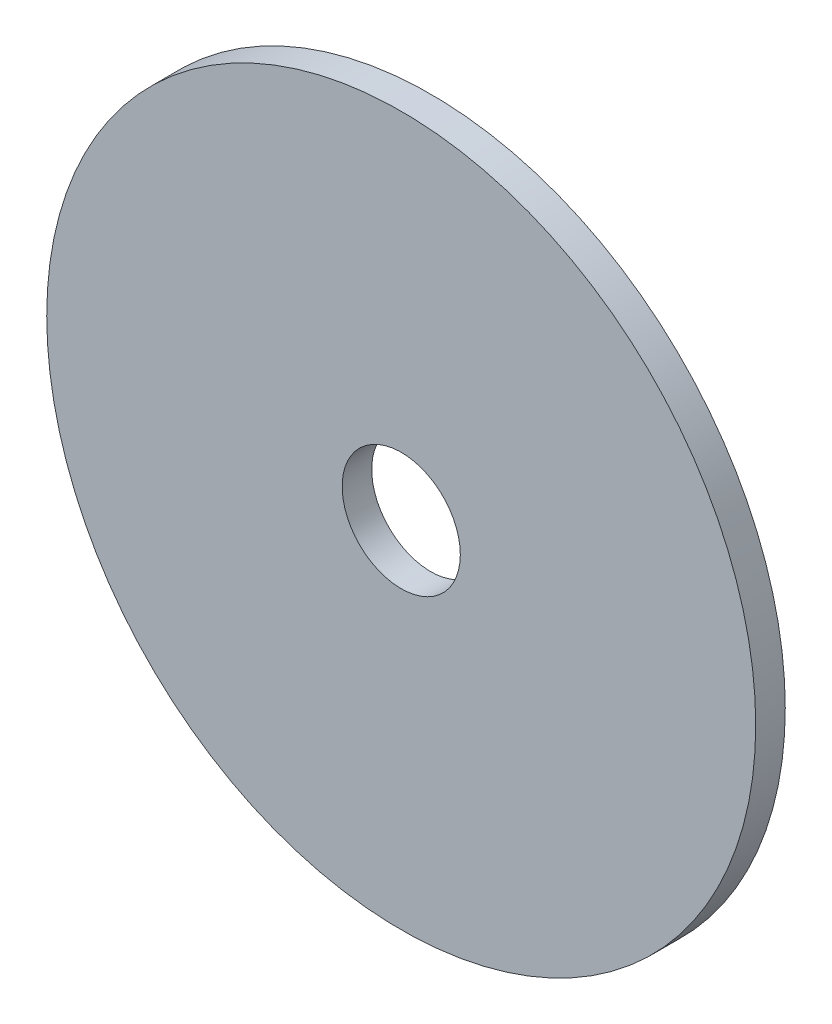
from build123d import *

# Parameters (mm, degrees)
SKETCH2_R           = 38.1
BOSS_EXTRUDE1_DEPTH = 3.175
CUT_EXTRUDE1_REACH  = 55.975
SKETCH3_R           = 6.35


with BuildPart() as part:
    # Sketch2 → Boss-Extrude1 (new body)
    with BuildSketch(Plane.XY):
        Circle(SKETCH2_R)
    extrude(amount=BOSS_EXTRUDE1_DEPTH)

    # Sketch3 → Cut-Extrude1 (cut, up to next)
    with BuildSketch(Plane.XY.offset(3.175), mode=Mode.PRIVATE) as cut_extrude1_sk1:
        Circle(SKETCH3_R)
    cut_extrude1_tool1 = extrude(cut_extrude1_sk1.sketch, amount=-CUT_EXTRUDE1_REACH, mode=Mode.PRIVATE) & part.part
    add(cut_extrude1_tool1.solids().sort_by_distance((0, 0, 3.175))[0], mode=Mode.SUBTRACT)


solid = part.part
